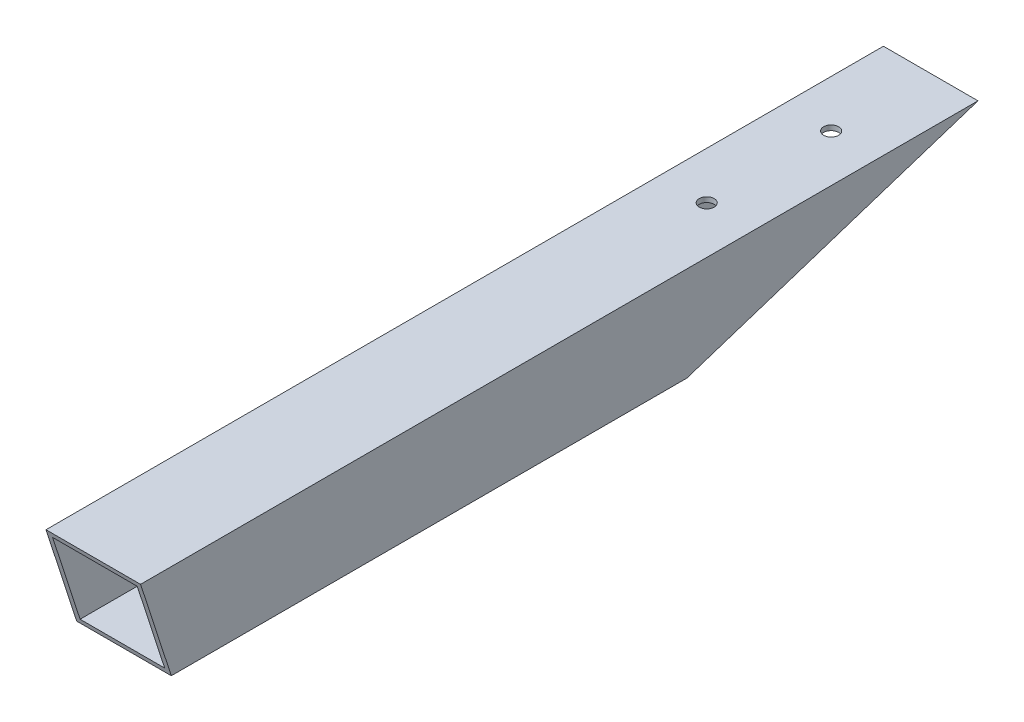
from build123d import *

# Parameters (mm, degrees)
ESBO_O1_W                = 19
ESBO_O1_H                = 19
RESSALTO_EXTRUS_O1_DEPTH = 260
CASCA2_T                 = -1
CORTE_EXTRUS_O1_DEPTH    = 261.866345089
CORTE_EXTRUS_O3_DEPTH    = 261.866345089
ESBO_O5_R                = 1.5
CORTE_EXTRUS_O4_DEPTH    = 170.569790677


with BuildPart() as part:
    # Esboço1 → Ressalto-extrusão1 (new body)
    with BuildSketch(Plane.XY):
        Rectangle(ESBO_O1_W, ESBO_O1_H)
    extrude(amount=RESSALTO_EXTRUS_O1_DEPTH)

    # Casca2
    casca2_openings = [part.faces().sort_by_distance(p)[0] for p in [
        (0, 0, 260),
        (0, 0, 0),
    ]]
    offset(amount=CASCA2_T, openings=casca2_openings, kind=Kind.INTERSECTION)

    # Esboço2 → Corte-extrusão1 (cut, through all)
    with BuildSketch(Plane(origin=(9.5, 0, 0), x_dir=(0, 0, -1), z_dir=(1, 0, 0))):
        Polygon((0, 9.5), (-58.475987206, -9.5), (0, -9.5), align=None)
    extrude(amount=-CORTE_EXTRUS_O1_DEPTH, mode=Mode.SUBTRACT)

    # Esboço4 → Corte-extrusão3 (cut, through all)
    with BuildSketch(Plane(origin=(9.5, 0, 0), x_dir=(0, 0, -1), z_dir=(1, 0, 0))):
        Polygon((-168.550335734, 10.473717073), (-161.289503816, -11.872825786), (-264.812755879, -45.509569399), (-289.05777752, 22.149749677), (-184.516070462, 59.611196004), align=None)
    extrude(amount=-CORTE_EXTRUS_O3_DEPTH, mode=Mode.SUBTRACT)

    # Esboço5 → Corte-extrusão4 (cut, through all)
    with BuildSketch(Plane(origin=(0, 9.5, 0), x_dir=(1, 0, 0), z_dir=(0, 1, 0))):
        with Locations(Location((0, -20, 0), (0, 0, 270))):
            Circle(ESBO_O5_R)
        with Locations(Location((0, -45, 0), (0, 0, 270))):
            Circle(ESBO_O5_R)
    extrude(amount=-CORTE_EXTRUS_O4_DEPTH, mode=Mode.SUBTRACT)


solid = part.part
